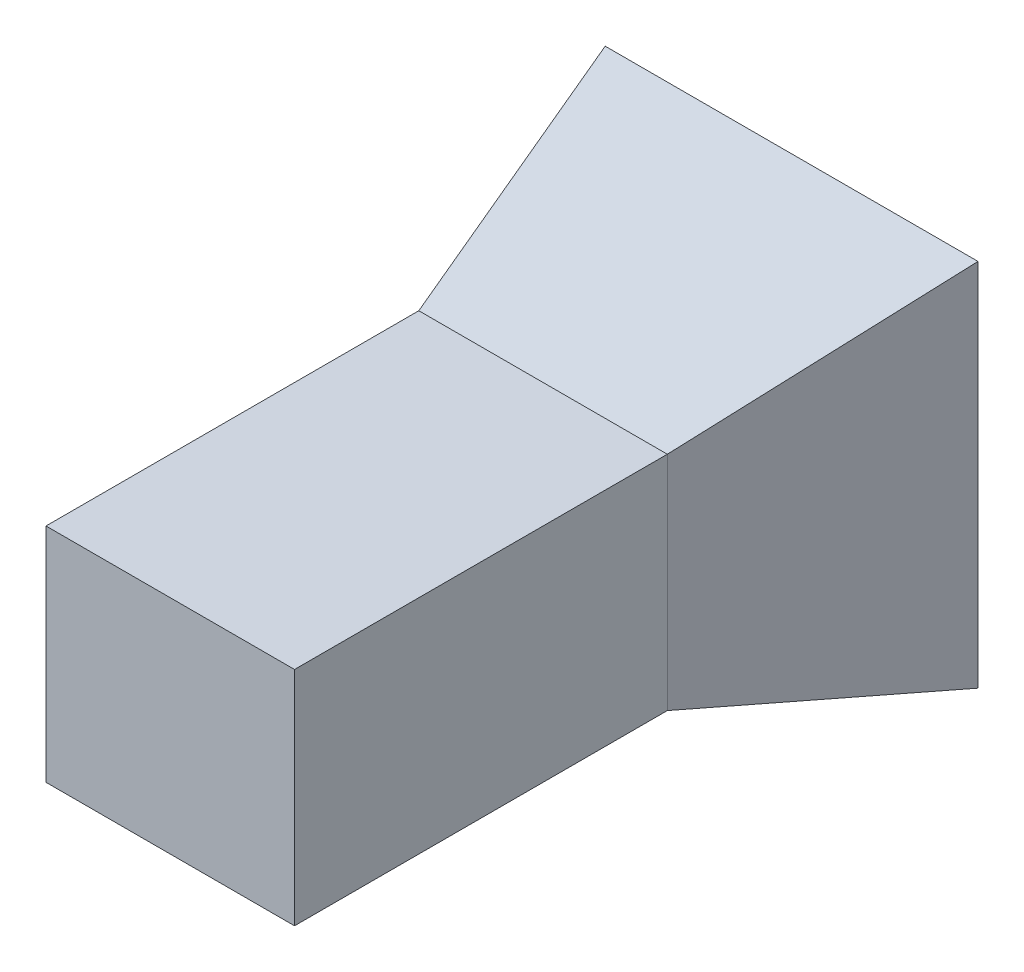
from build123d import *

# Parameters (mm, degrees)
SKETCH3_W           = 20
SKETCH3_H           = 17.866253804
BOSS_EXTRUDE1_DEPTH = 30


with BuildPart() as part:
    # Sketch1 → Loft1 section 0
    with BuildSketch(Plane.XY):
        with BuildLine():
            Line((-15, 14.870689655), (15, 14.870689655))
            Line((15, 14.870689655), (15, -14.870689655))
            Line((15, -14.870689655), (-15, -14.870689655))
            Line((-15, -14.870689655), (-15, 14.870689655))
        make_face()
    # Sketch2 → Loft1 section 1
    with BuildSketch(Plane.XY.offset(20)):
        with BuildLine():
            Line((-10, 8.933126902), (10, 8.933126902))
            Line((10, 8.933126902), (10, -8.933126902))
            Line((10, -8.933126902), (-10, -8.933126902))
            Line((-10, -8.933126902), (-10, 8.933126902))
        make_face()
    loft()

    # Sketch3 → Boss-Extrude1 (add)
    with BuildSketch(Plane.XY.offset(20)):
        Rectangle(SKETCH3_W, SKETCH3_H)
    extrude(amount=BOSS_EXTRUDE1_DEPTH)


solid = part.part
